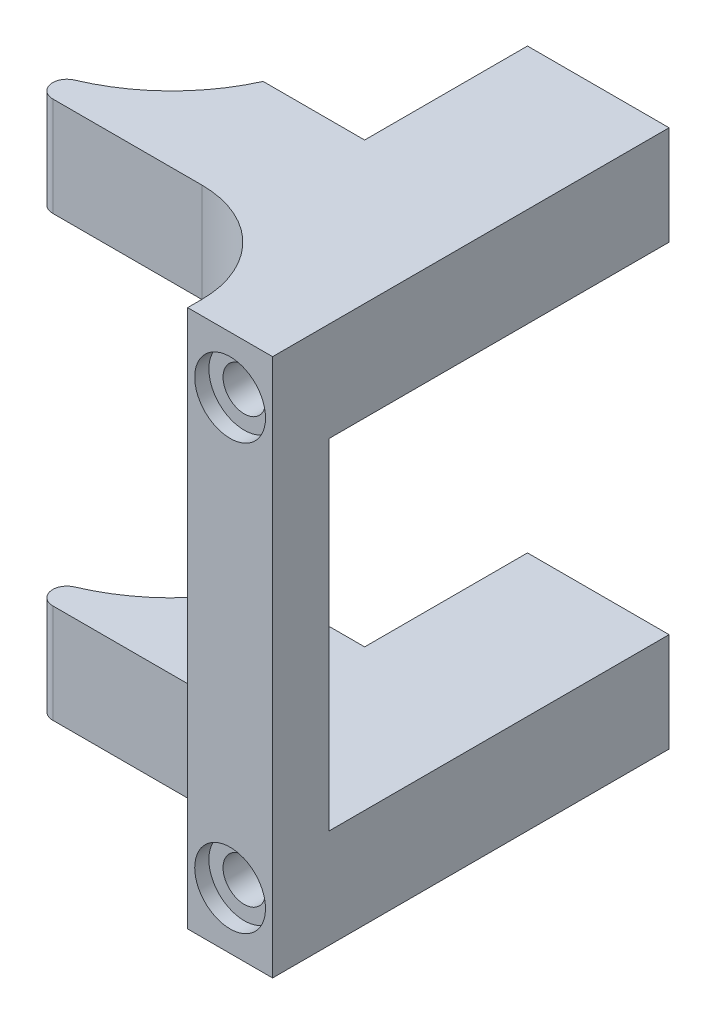
from build123d import *

# Parameters (mm, degrees)
SKETCH_1_W          = 10
SKETCH_1_H          = 20
EXTRUDE_1_DEPTH     = 38
EXTRUDE_5_DEPTH     = 38
SKETCH_2_R          = 1.5
CUT_EXTRUDE_1_DEPTH = 48.171856459
SKETCH_10_W         = 20
SKETCH_10_H         = 24
CUT_EXTRUDE_3_DEPTH = 47.318715363
SKETCH_11_W         = 6
SKETCH_11_H         = 7
SKETCH_11_R         = 1.5
EXTRUDE_6_DEPTH     = 8
SKETCH_12_W         = 6
SKETCH_12_H         = 4
EXTRUDE_7_DEPTH     = 24
FILLET_1_R          = 7
SKETCH_13_R         = 2.5
CUT_EXTRUDE_4_DEPTH = 1


with BuildPart() as part:
    # 草图1 → 凸台-拉伸1 (new body)
    with BuildSketch(Plane(origin=(0, 0, 0), x_dir=(1, 0, 0), z_dir=(0, 1, 0))):
        Rectangle(SKETCH_1_W, SKETCH_1_H)
    extrude(amount=EXTRUDE_1_DEPTH)

    # 草图3 → 凸台-拉伸5 (add)
    with BuildSketch(Plane.XZ):
        with BuildLine():
            Line((-18.523935101, 10), (-5, 10))
            Line((-5, 10), (-5, 1.5))
            Line((-5, 1.5), (-12.167093619, 1.5))
            ThreePointArc((-12.167093619, 1.5), (-14.923808101, 5.422873363), (-18.915039541, 8.079653697))
            ThreePointArc((-18.915039541, 8.079653697), (-19.503819355, 9.199566652), (-18.523935101, 10))
        make_face()
    extrude(amount=-EXTRUDE_5_DEPTH)

    # 草图2 → 切除-拉伸1 (cut, through all)
    with BuildSketch(Plane.XY.offset(10)):
        with Locations((2, 4)):
            Circle(SKETCH_2_R)
        with Locations(Location((2, 34, 0), (0, 0, 180))):
            Circle(SKETCH_2_R)
    extrude(amount=-CUT_EXTRUDE_1_DEPTH, mode=Mode.SUBTRACT)

    # 草图10 → 切除-拉伸3 (cut, through all)
    with BuildSketch(Plane(origin=(5, 0, 0), x_dir=(0, 0, -1), z_dir=(1, 0, 0))):
        with Locations((0, 19)):
            Rectangle(SKETCH_10_W, SKETCH_10_H)
    extrude(amount=-CUT_EXTRUDE_3_DEPTH, mode=Mode.SUBTRACT)


with BuildPart() as cut_extrude_3_piece_1:
    # of the separate pieces the step leaves, piece 1, a body of its own (cut_extrude_3_pieces)
    add(part.part.solids().sort_by_distance((5, 31, 10))[0])



with BuildPart() as cut_extrude_3_piece_2:
    # of the separate pieces the step leaves, piece 2, a body of its own (cut_extrude_3_pieces)
    add(part.part.solids().sort_by_distance((5, 0, 10))[0])


with BuildPart() as cut_extrude_3_piece_1_1:
    add(cut_extrude_3_piece_1.part)

    add(cut_extrude_3_piece_2.part)  # 凸台-拉伸6 merges 切除-拉伸3 piece 2
    # 草图11 → 凸台-拉伸6 (add)
    # profile 1 of 2: a face of its own
    with BuildSketch(Plane.XY.offset(10)):
        with Locations((2, 3.5)):
            Rectangle(SKETCH_11_W, SKETCH_11_H)
        with Locations((2, 4)):
            Circle(SKETCH_11_R, mode=Mode.SUBTRACT)
    # profile 2 of 2: a face of its own
    with BuildSketch(Plane.XY.offset(10)):
        with Locations((2, 34.5)):
            Rectangle(SKETCH_11_W, SKETCH_11_H)
        with Locations(Location((2, 34, 0), (0, 0, 180))):
            Circle(SKETCH_11_R, mode=Mode.SUBTRACT)
    extrude(amount=EXTRUDE_6_DEPTH)

    # 草图12 → 凸台-拉伸7 (add)
    with BuildSketch(Plane.XZ.offset(-31)):
        with Locations((2, 16)):
            Rectangle(SKETCH_12_W, SKETCH_12_H)
    extrude(amount=EXTRUDE_7_DEPTH)

    # 圆角1
    fillet_1_edges = [cut_extrude_3_piece_1_1.edges().sort_by_distance(p)[0] for p in [
        (-1, 3.5, 10),
    ]]
    fillet(fillet_1_edges, radius=FILLET_1_R)

    # 草图13 → 切除-拉伸4 (cut)
    with BuildSketch(Plane.XY.offset(18)):
        with Locations((2, 34)):
            Circle(SKETCH_13_R)
        with Locations(Location((2, 4, 0), (0, 0, 180))):
            Circle(SKETCH_13_R)
    extrude(amount=-CUT_EXTRUDE_4_DEPTH, mode=Mode.SUBTRACT)


solid = cut_extrude_3_piece_1_1.part
